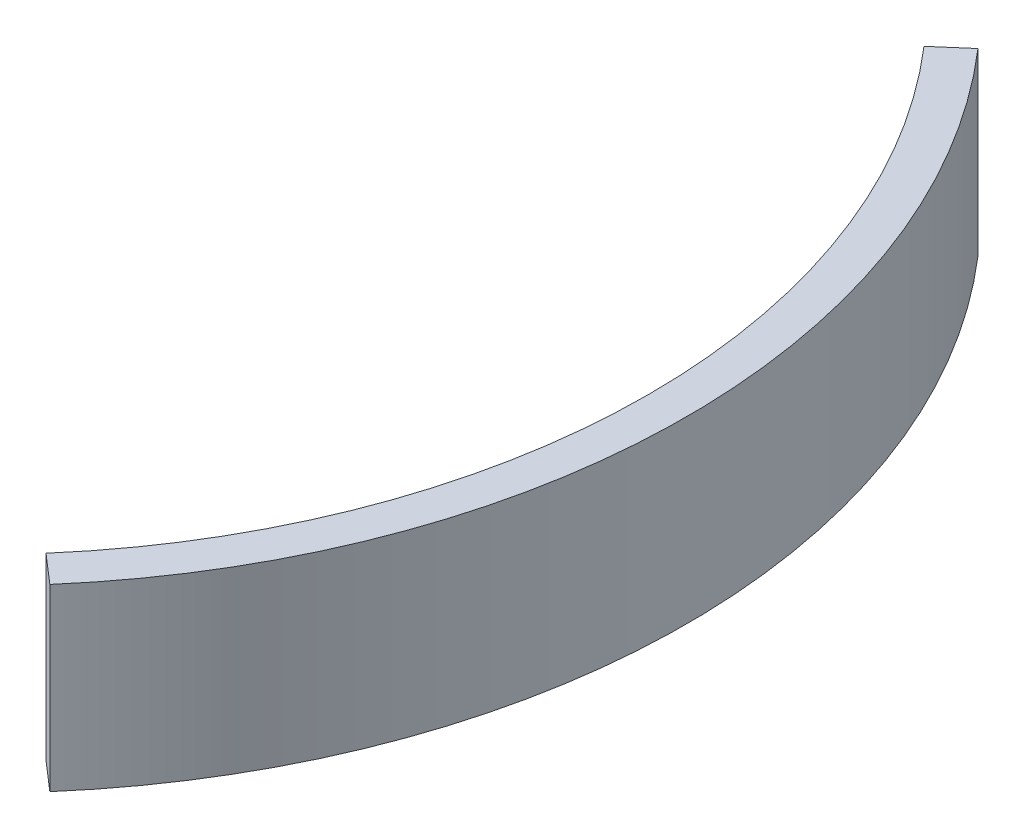
from build123d import *

# Parameters (mm, degrees)
BOSS_EXTRUDE1_DEPTH = 15


with BuildPart() as part:
    # Sketch1 → Boss-Extrude1 (new body)
    with BuildSketch(Plane(origin=(0, 0, 0), x_dir=(1, 0, 0), z_dir=(0, 1, 0))):
        with BuildLine():
            Line((42.311435415, 36.684362242), (44.729231725, 38.780611513))
            ThreePointArc((44.729231725, 38.780611513), (59.2, 0), (44.729231725, -38.780611513))
            Line((44.729231725, -38.780611513), (42.311435415, -36.684362242))
            ThreePointArc((42.311435415, -36.684362242), (56, 0), (42.311435415, 36.684362242))
        make_face()
    extrude(amount=BOSS_EXTRUDE1_DEPTH)


solid = part.part
